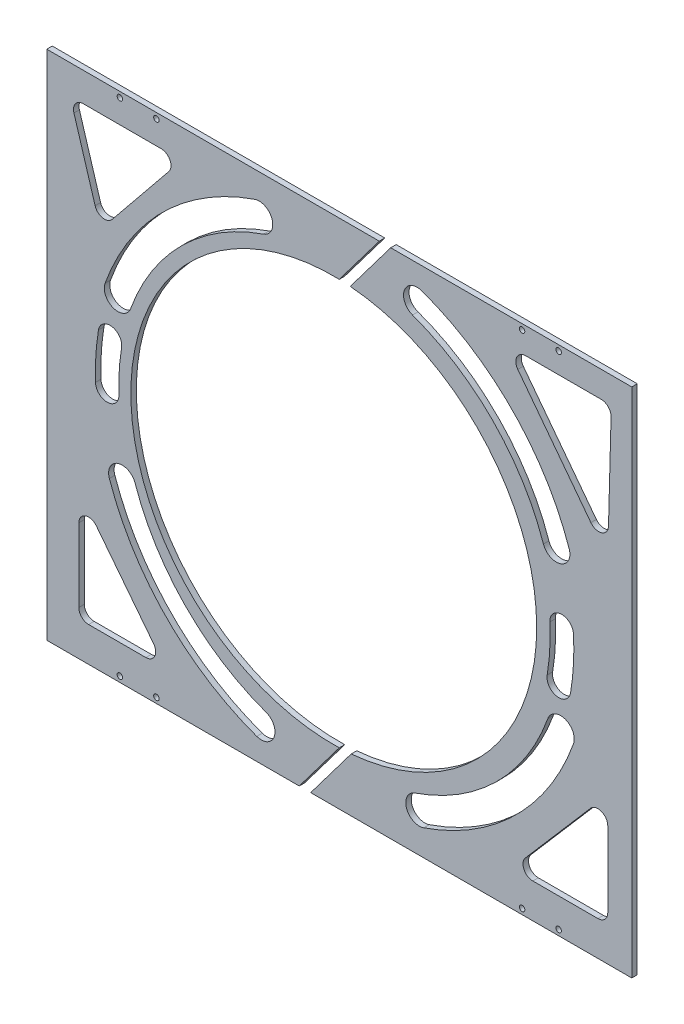
from build123d import *

# Parameters (mm, degrees)
EXTRUDE_1_DEPTH     = 1.5
EXTRUDE_1_2_DEPTH   = 1.5
SKETCH_2_R          = 1.5
CUT_EXTRUDE_1_DEPTH = 3
CUT_EXTRUDE_3_DEPTH = 3


with BuildPart() as part:
    # 草图1 → 凸台-拉伸1 (new, symmetric)
    with BuildSketch(Plane.XY):
        with BuildLine():
            Line((0, 110.959452053), (21.883622522, 140))
            Line((21.883622522, 140), (-160, 140))
            Line((-160, 140), (-160, -140))
            Line((-160, -140), (-21.883622522, -140))
            Line((-21.883622522, -140), (0, -110.959452053))
            ThreePointArc((0, -110.959452053), (-114, 0), (0, 110.959452053))
        make_face()
    extrude(amount=EXTRUDE_1_DEPTH, both=True)


with BuildPart() as body_2:
    # 草图1 → Extrude 1 2 (new, symmetric)
    with BuildSketch(Plane.XY):
        with BuildLine():
            Line((160, 140), (28.144300813, 140))
            Line((28.144300813, 140), (6.014919263, 110.633318809))
            ThreePointArc((6.014919263, 110.633318809), (78.613895993, 75.234114475), (108, 0))
            ThreePointArc((108, 0), (78.792100532, -75.040337756), (6.53959837, -110.589312607))
            Line((6.53959837, -110.589312607), (-15.622944232, -140))
            Line((-15.622944232, -140), (160, -140))
            Line((160, -140), (160, 140))
        make_face()
    extrude(amount=EXTRUDE_1_2_DEPTH, both=True)


with BuildPart() as cut_extrude_1_tool:
    # 草图2 → 切除-拉伸1 (new body)
    with BuildSketch(Plane(origin=(0, 0, -1.5), x_dir=(-1, 0, 0), z_dir=(0, 0, -1))):
        with Locations((-120, -137)):
            Circle(SKETCH_2_R)
        with Locations((-100, -137)):
            Circle(SKETCH_2_R)
        with Locations((100, -137)):
            Circle(SKETCH_2_R)
        with Locations((120, -137)):
            Circle(SKETCH_2_R)
        with Locations((-120, 137)):
            Circle(SKETCH_2_R)
        with Locations((-100, 137)):
            Circle(SKETCH_2_R)
        with Locations((100, 137)):
            Circle(SKETCH_2_R)
        with Locations((120, 137)):
            Circle(SKETCH_2_R)
    extrude(amount=-CUT_EXTRUDE_1_DEPTH)


with BuildPart() as part_1:
    add(part.part)

    # 切除-拉伸1: cut by cut_extrude_1_tool
    add(cut_extrude_1_tool.part, mode=Mode.SUBTRACT)


with BuildPart() as body_2_1:
    add(body_2.part)

    # 切除-拉伸1: cut by cut_extrude_1_tool
    add(cut_extrude_1_tool.part, mode=Mode.SUBTRACT)


with BuildPart() as cut_extrude_3_tool:
    # 草图4 → 切除-拉伸3 (new body)
    with BuildSketch(Plane.XY.offset(1.5)):
        with BuildLine():
            Line((-139.992390357, 124.147421904), (-97.418038821, 124.147421904))
            ThreePointArc((-97.418038821, 124.147421904), (-92.569606066, 121.086277274), (-93.248624404, 115.392698372))
            Line((-93.248624404, 115.392698372), (-124.230680923, 77.225741538))
            ThreePointArc((-124.230680923, 77.225741538), (-129.432739134, 75.340288216), (-133.538512929, 79.049596157))
            Line((-133.538512929, 79.049596157), (-145.130807945, 117.216552991))
            ThreePointArc((-145.130807945, 117.216552991), (-144.306329369, 121.975498052), (-139.992390357, 124.147421904))
        make_face()
        with BuildLine():
            Line((-142.45565501, -75.588541558), (-142.45565501, -115.721760711))
            ThreePointArc((-142.45565501, -115.721760711), (-140.88276038, -119.519064258), (-137.085456833, -121.091958888))
            Line((-137.085456833, -121.091958888), (-105.784106601, -121.091958888))
            ThreePointArc((-105.784106601, -121.091958888), (-100.958391842, -118.077924016), (-101.549561931, -112.419086054))
            Line((-101.549561931, -112.419086054), (-132.850912162, -72.285866901))
            ThreePointArc((-132.850912162, -72.285866901), (-138.831693413, -70.510186877), (-142.45565501, -75.588541558))
        make_face()
        with BuildLine():
            Line((101.933407822, 125.748540433), (143.306554755, 125.748540433))
            ThreePointArc((143.306554755, 125.748540433), (147.154012413, 124.12482034), (148.674854143, 120.235548197))
            Line((148.674854143, 120.235548197), (147.27640952, 67.661446177))
            ThreePointArc((147.27640952, 67.661446177), (143.555279893, 62.692894011), (137.633281622, 64.553875693))
            Line((137.633281622, 64.553875693), (97.658579312, 117.127977712))
            ThreePointArc((97.658579312, 117.127977712), (97.122268133, 122.76412585), (101.933407822, 125.748540433))
        make_face()
        with BuildLine():
            Line((146.870598435, -74.418210265), (146.870598435, -115.721760711))
            ThreePointArc((146.870598435, -115.721760711), (145.297703806, -119.519064258), (141.500400259, -121.091958888))
            Line((141.500400259, -121.091958888), (105.871259166, -121.091958888))
            ThreePointArc((105.871259166, -121.091958888), (100.988839883, -117.958054609), (101.804919679, -112.214067504))
            Line((101.804919679, -112.214067504), (137.434060772, -70.910517058))
            ThreePointArc((137.434060772, -70.910517058), (143.371493463, -69.384519901), (146.870598435, -74.418210265))
        make_face()
        with BuildLine():
            ThreePointArc((-46.244777057, 125.748540433), (-96.323838646, 94.728387002), (-128.088563346, 45.118261089))
            ThreePointArc((-128.088563346, 45.118261089), (-123.615567907, 35.598047611), (-114.095354429, 40.07104305))
            ThreePointArc((-114.095354429, 40.07104305), (-85.884035548, 84.131462118), (-41.407138957, 111.681502246))
            ThreePointArc((-41.407138957, 111.681502246), (-36.792438914, 121.13384039), (-46.244777057, 125.748540433))
        make_face()
        with BuildLine():
            ThreePointArc((111.681502246, 41.407138957), (84.131462118, 85.884035548), (40.07104305, 114.095354429))
            ThreePointArc((40.07104305, 114.095354429), (35.598047611, 123.615567907), (45.118261089, 128.088563346))
            ThreePointArc((45.118261089, 128.088563346), (94.728387002, 96.323838646), (125.748540433, 46.244777057))
            ThreePointArc((125.748540433, 46.244777057), (121.13384039, 36.792438914), (111.681502246, 41.407138957))
        make_face()
        with BuildLine():
            ThreePointArc((41.407138957, -111.681502246), (85.884035548, -84.131462118), (114.095354429, -40.07104305))
            ThreePointArc((114.095354429, -40.07104305), (123.615567907, -35.598047611), (128.088563346, -45.118261089))
            ThreePointArc((128.088563346, -45.118261089), (96.323838646, -94.728387002), (46.244777057, -125.748540433))
            ThreePointArc((46.244777057, -125.748540433), (36.792438914, -121.13384039), (41.407138957, -111.681502246))
        make_face()
        with BuildLine():
            ThreePointArc((-111.681502246, -41.407138957), (-84.131462118, -85.884035548), (-40.07104305, -114.095354429))
            ThreePointArc((-40.07104305, -114.095354429), (-35.598047611, -123.615567907), (-45.118261089, -128.088563346))
            ThreePointArc((-45.118261089, -128.088563346), (-94.728387002, -96.323838646), (-125.748540433, -46.244777057))
            ThreePointArc((-125.748540433, -46.244777057), (-121.13384039, -36.792438914), (-111.681502246, -41.407138957))
        make_face()
        with BuildLine():
            ThreePointArc((-131.719404925, 21.113052626), (-133.172826246, 8.33555652), (-133.360995061, -4.522959442))
            ThreePointArc((-133.360995061, -4.522959442), (-126.730583963, -10.708705635), (-120.544837771, -4.078294536))
            ThreePointArc((-120.544837771, -4.078294536), (-120.375168363, 7.516064437), (-119.064636993, 19.037368844))
            ThreePointArc((-119.064636993, 19.037368844), (-124.354179068, 26.402594701), (-131.719404925, 21.113052626))
        make_face()
        with BuildLine():
            ThreePointArc((126.504130375, -21.740908346), (128.105745697, -7.434401461), (128.131708776, 6.961453387))
            ThreePointArc((128.131708776, 6.961453387), (121.323666672, 13.083091226), (115.202028833, 6.275049122))
            ThreePointArc((115.202028833, 6.275049122), (115.178625732, -6.701364178), (113.734930822, -19.597239288))
            ThreePointArc((113.734930822, -19.597239288), (119.047696069, -27.053673594), (126.504130375, -21.740908346))
        make_face()
    extrude(amount=-CUT_EXTRUDE_3_DEPTH)


with BuildPart() as part_2:
    add(part_1.part)

    # 切除-拉伸3: cut by cut_extrude_3_tool
    add(cut_extrude_3_tool.part, mode=Mode.SUBTRACT)


with BuildPart() as body_2_2:
    add(body_2_1.part)

    # 切除-拉伸3: cut by cut_extrude_3_tool
    add(cut_extrude_3_tool.part, mode=Mode.SUBTRACT)


solid = Compound([part_2.part, body_2_2.part])
